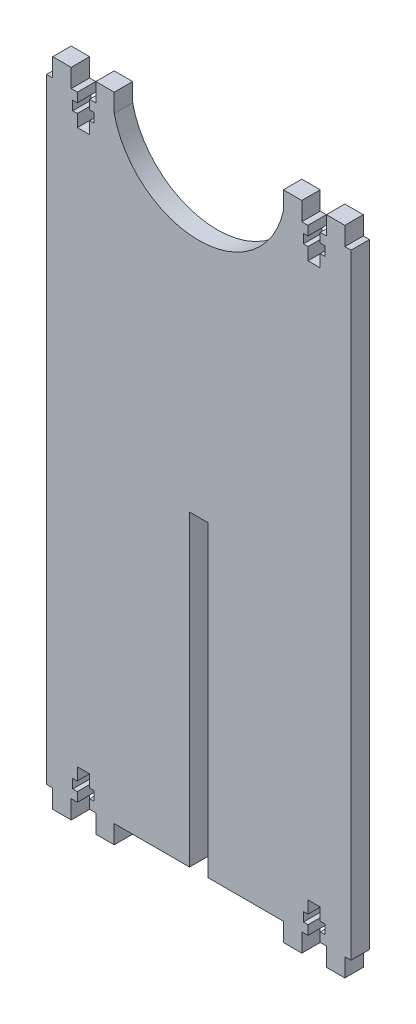
from build123d import *

# Parameters (mm, degrees)
BOSS_EXTRU_1_DEPTH      = 6
ENL_V_MAT_EXTRU_1_DEPTH = 10


with BuildPart() as part:
    # Esquisse1 → Boss.-Extru.1 (new body)
    with BuildSketch(Plane.XY):
        Polygon((-40.636697438, 45.053641116), (-40.636697438, 39.053641116), (-42.636697438, 39.053641116), (-42.636697438, -160.946358884), (-40.636697438, -160.946358884), (-40.636697438, -166.946358884), (-34.636697438, -166.946358884), (-34.636697438, -160.946358884), (-32.636697438, -160.946358884), (-32.636697438, -157.946358884), (-34.136697438, -157.946358884), (-34.136697438, -154.946358884), (-32.636697438, -154.946358884), (-32.636697438, -150.946358884), (-28.636697438, -150.946358884), (-28.636697438, -154.946358884), (-27.136697438, -154.946358884), (-27.136697438, -157.946358884), (-28.636697438, -157.946358884), (-28.636697438, -160.946358884), (-26.636697438, -160.946358884), (-26.636697438, -166.946358884), (-20.636697438, -166.946358884), (-20.636697438, -160.946358884), (3.863302562, -160.946358884), (3.863302562, -60.946358884), (6.863302562, -60.946358884), (6.863302562, 39.053641116), (-20.636697438, 39.053641116), (-20.636697438, 45.053641116), (-26.636697438, 45.053641116), (-26.636697438, 39.053641116), (-28.636697438, 39.053641116), (-28.636697438, 36.053641116), (-27.136697438, 36.053641116), (-27.136697438, 33.053641116), (-28.636697438, 33.053641116), (-28.636697438, 29.053641116), (-32.636697438, 29.053641116), (-32.636697438, 33.053641116), (-34.136697438, 33.053641116), (-34.136697438, 36.053641116), (-32.636697438, 36.053641116), (-32.636697438, 39.053641116), (-34.636697438, 39.053641116), (-34.636697438, 45.053641116), align=None)
        Polygon((34.363302562, 39.053641116), (6.863302562, 39.053641116), (6.863302562, -60.946358884), (9.863302562, -60.946358884), (9.863302562, -160.946358884), (34.363302562, -160.946358884), (34.363302562, -166.946358884), (40.363302562, -166.946358884), (40.363302562, -160.946358884), (42.363302562, -160.946358884), (42.363302562, -157.946358884), (40.863302562, -157.946358884), (40.863302562, -154.946358884), (42.363302562, -154.946358884), (42.363302562, -150.946358884), (46.363302562, -150.946358884), (46.363302562, -154.946358884), (47.863302562, -154.946358884), (47.863302562, -157.946358884), (46.363302562, -157.946358884), (46.363302562, -160.946358884), (48.363302562, -160.946358884), (48.363302562, -166.946358884), (54.363302562, -166.946358884), (54.363302562, -160.946358884), (56.363302562, -160.946358884), (56.363302562, 39.053641116), (54.363302562, 39.053641116), (54.363302562, 45.053641116), (48.363302562, 45.053641116), (48.363302562, 39.053641116), (46.363302562, 39.053641116), (46.363302562, 36.053641116), (47.863302562, 36.053641116), (47.863302562, 33.053641116), (46.363302562, 33.053641116), (46.363302562, 29.053641116), (42.363302562, 29.053641116), (42.363302562, 33.053641116), (40.863302562, 33.053641116), (40.863302562, 36.053641116), (42.363302562, 36.053641116), (42.363302562, 39.053641116), (40.363302562, 39.053641116), (40.363302562, 45.053641116), (34.363302562, 45.053641116), align=None)
    extrude(amount=BOSS_EXTRU_1_DEPTH)

    # Esquisse2 → Enlèv. mat.-Extru.1 (cut)
    with BuildSketch(Plane.XY.offset(6)):
        with BuildLine():
            Line((-20.636697438, 39.053641116), (34.363302562, 39.053641116))
            ThreePointArc((34.363302562, 39.053641116), (6.863302562, 17.053641116), (-20.636697438, 39.053641116))
        make_face()
    extrude(amount=-ENL_V_MAT_EXTRU_1_DEPTH, mode=Mode.SUBTRACT)


solid = part.part
